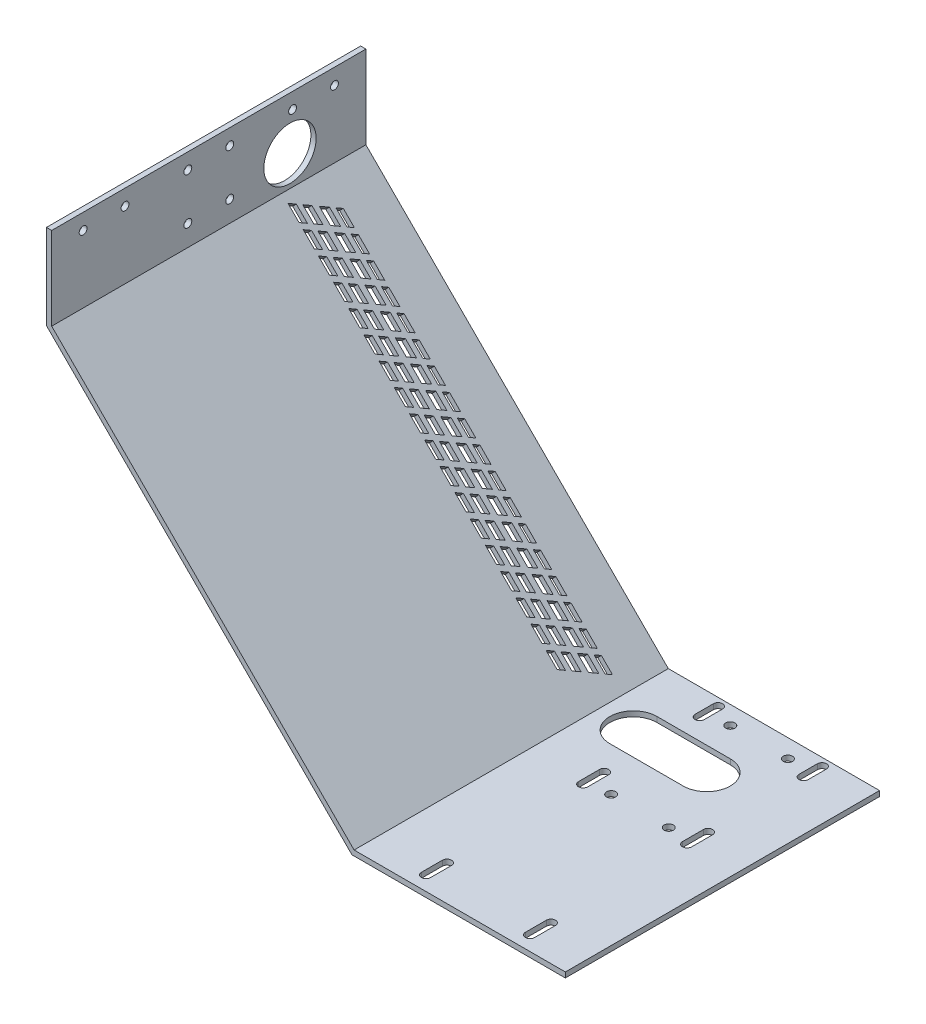
from build123d import *

# Parameters (mm, degrees)
EXTRUDE_1_DEPTH             = 120
CUT_EXTRUDE_1_DEPTH         = 307.169012533
CUT_EXTRUDE_2_DEPTH         = 277.26473236
CUT_EXTRUDE_3_DEPTH         = 277.26473236
CUT_EXTRUDE_4_DEPTH         = 277.26473236
CUT_EXTRUDE_5_DEPTH         = 277.26473236
CUT_EXTRUDE_6_DEPTH         = 277.26473236
CUT_EXTRUDE_7_DEPTH         = 277.26473236
CUT_EXTRUDE_8_DEPTH         = 204.855311096
CUT_EXTRUDE_9_DEPTH         = 204.855311096
CUT_EXTRUDE_10_DEPTH        = 204.855311096
CUT_EXTRUDE_11_DEPTH        = 204.855311096
CUT_EXTRUDE_12_DEPTH        = 204.855311096
CUT_EXTRUDE_13_DEPTH        = 204.855311096
CUT_EXTRUDE_14_DEPTH        = 204.855311096
CUT_EXTRUDE_15_DEPTH        = 204.855311096
CUT_EXTRUDE_16_DEPTH        = 204.855311096
CUT_EXTRUDE_17_DEPTH        = 204.855311096
CUT_EXTRUDE_18_DEPTH        = 204.855311096
CUT_EXTRUDE_19_DEPTH        = 204.855311096
CUT_EXTRUDE_20_DEPTH        = 204.855311096
CUT_EXTRUDE_21_DEPTH        = 204.855311096
CUT_EXTRUDE_22_DEPTH        = 204.855311096
CUT_EXTRUDE_23_DEPTH        = 204.855311096
CUT_EXTRUDE_24_DEPTH        = 204.855311096
CUT_EXTRUDE_25_DEPTH        = 204.855311096
CUT_EXTRUDE_26_DEPTH        = 204.855311096
CUT_EXTRUDE_27_DEPTH        = 204.855311096
CUT_EXTRUDE_28_DEPTH        = 204.855311096
CUT_EXTRUDE_29_DEPTH        = 204.855311096
CUT_EXTRUDE_30_DEPTH        = 204.855311096
CUT_EXTRUDE_31_DEPTH        = 204.855311096
CUT_EXTRUDE_32_DEPTH        = 204.855311096
CUT_EXTRUDE_33_DEPTH        = 204.855311096
CUT_EXTRUDE_34_DEPTH        = 204.855311096
CUT_EXTRUDE_35_DEPTH        = 204.855311096
CUT_EXTRUDE_36_DEPTH        = 204.855311096
CUT_EXTRUDE_37_DEPTH        = 204.855311096
CUT_EXTRUDE_38_DEPTH        = 204.855311096
CUT_EXTRUDE_39_DEPTH        = 204.855311096
CUT_EXTRUDE_40_DEPTH        = 204.855311096
CUT_EXTRUDE_41_DEPTH        = 204.855311096
CUT_EXTRUDE_42_DEPTH        = 204.855311096
CUT_EXTRUDE_43_DEPTH        = 204.855311096
CUT_EXTRUDE_44_DEPTH        = 204.855311096
CUT_EXTRUDE_45_DEPTH        = 204.855311096
CUT_EXTRUDE_46_DEPTH        = 204.855311096
CUT_EXTRUDE_47_DEPTH        = 204.855311096
CUT_EXTRUDE_48_DEPTH        = 204.855311096
CUT_EXTRUDE_49_DEPTH        = 204.855311096
CUT_EXTRUDE_50_DEPTH        = 204.855311096
CUT_EXTRUDE_51_DEPTH        = 204.855311096
CUT_EXTRUDE_52_DEPTH        = 204.855311096
CUT_EXTRUDE_53_DEPTH        = 204.855311096
CUT_EXTRUDE_54_DEPTH        = 204.855311096
CUT_EXTRUDE_55_DEPTH        = 204.855311096
CUT_EXTRUDE_56_DEPTH        = 204.855311096
CUT_EXTRUDE_57_DEPTH        = 204.855311096
CUT_EXTRUDE_58_DEPTH        = 204.855311096
CUT_EXTRUDE_59_DEPTH        = 204.855311096
CUT_EXTRUDE_60_DEPTH        = 204.855311096
CUT_EXTRUDE_61_DEPTH        = 204.855311096
CUT_EXTRUDE_62_DEPTH        = 204.855311096
CUT_EXTRUDE_63_DEPTH        = 204.855311096
CUT_EXTRUDE_64_DEPTH        = 204.855311096
CUT_EXTRUDE_65_DEPTH        = 204.855311096
CUT_EXTRUDE_66_DEPTH        = 204.855311096
CUT_EXTRUDE_67_DEPTH        = 204.855311096
CUT_EXTRUDE_68_DEPTH        = 204.855311096
CUT_EXTRUDE_69_DEPTH        = 204.855311096
CUT_EXTRUDE_70_DEPTH        = 204.855311096
CUT_EXTRUDE_71_DEPTH        = 204.855311096
CUT_EXTRUDE_72_DEPTH        = 204.855311096
CUT_EXTRUDE_73_DEPTH        = 204.855311096
CUT_EXTRUDE_74_DEPTH        = 204.855311096
CUT_EXTRUDE_75_DEPTH        = 204.855311096
CUT_EXTRUDE_76_DEPTH        = 204.855311096
CUT_EXTRUDE_77_DEPTH        = 204.855311096
CUT_EXTRUDE_78_DEPTH        = 204.855311096
CUT_EXTRUDE_79_DEPTH        = 204.855311096
CUT_EXTRUDE_80_DEPTH        = 276.189955977
HOLE_WIZARD_20_0_20_1_D     = 20
HOLE_WIZARD_20_0_20_1_DEPTH = 198.172618896
HOLE_WIZARD_3_0_3_1_D       = 3
HOLE_WIZARD_3_0_3_1_DEPTH   = 198.172618896
HOLE_WIZARD_3_5_3_5_1_D     = 3.5
HOLE_WIZARD_3_5_3_5_1_DEPTH = 149.172618896
HOLE_WIZARD_3_0_3_2_D       = 3


with BuildPart() as part:
    # 草图1 → 凸台-拉伸1 (new body)
    with BuildSketch(Plane(origin=(0, 0, 0), x_dir=(-1, 0, 0), z_dir=(0, 0, -1))):
        Polygon((199.172618896, -50), (1, -50), (1, -199.172618896), (82.5, -199.172618896), (199.172618896, -82.5), align=None)
    extrude(amount=-EXTRUDE_1_DEPTH)

    # 草图2 → 切除-拉伸1 (cut, through all)
    with BuildSketch(Plane.XY.offset(120)):
        Polygon((-197.172618896, -50), (-197.172618896, -81.671572875), (-81.671572875, -197.172618896), (-1, -197.172618896), (-1, -50), align=None)
    extrude(amount=-CUT_EXTRUDE_1_DEPTH, mode=Mode.SUBTRACT)

    # 草图3 → 切除-拉伸2 (cut, through all)
    with BuildSketch(Plane.XZ.offset(199.172618896)):
        with BuildLine():
            Line((-57.95, 106.5), (-57.95, 114.5))
            ThreePointArc((-57.95, 114.5), (-59.7, 116.25), (-61.45, 114.5))
            Line((-61.45, 114.5), (-61.45, 106.5))
            ThreePointArc((-61.45, 106.5), (-59.7, 104.75), (-57.95, 106.5))
        make_face()
    extrude(amount=-CUT_EXTRUDE_2_DEPTH, mode=Mode.SUBTRACT)

    # 草图4 → 切除-拉伸3 (cut, through all)
    with BuildSketch(Plane.XZ.offset(199.172618896)):
        with BuildLine():
            Line((-18.25, 106.5), (-18.25, 114.5))
            ThreePointArc((-18.25, 114.5), (-20, 116.25), (-21.75, 114.5))
            Line((-21.75, 114.5), (-21.75, 106.5))
            ThreePointArc((-21.75, 106.5), (-20, 104.75), (-18.25, 106.5))
        make_face()
    extrude(amount=-CUT_EXTRUDE_3_DEPTH, mode=Mode.SUBTRACT)

    # 草图5 → 切除-拉伸4 (cut, through all)
    with BuildSketch(Plane.XZ.offset(199.172618896)):
        with BuildLine():
            Line((-61.45, 54.5), (-61.45, 46.5))
            ThreePointArc((-61.45, 46.5), (-59.7, 44.75), (-57.95, 46.5))
            Line((-57.95, 46.5), (-57.95, 54.5))
            ThreePointArc((-57.95, 54.5), (-59.7, 56.25), (-61.45, 54.5))
        make_face()
    extrude(amount=-CUT_EXTRUDE_4_DEPTH, mode=Mode.SUBTRACT)

    # 草图6 → 切除-拉伸5 (cut, through all)
    with BuildSketch(Plane.XZ.offset(199.172618896)):
        with BuildLine():
            Line((-21.75, 54.5), (-21.75, 46.5))
            ThreePointArc((-21.75, 46.5), (-20, 44.75), (-18.25, 46.5))
            Line((-18.25, 46.5), (-18.25, 54.5))
            ThreePointArc((-18.25, 54.5), (-20, 56.25), (-21.75, 54.5))
        make_face()
    extrude(amount=-CUT_EXTRUDE_5_DEPTH, mode=Mode.SUBTRACT)

    # 草图7 → 切除-拉伸6 (cut, through all)
    with BuildSketch(Plane.XZ.offset(199.172618896)):
        with BuildLine():
            Line((-61.45, 10), (-61.45, 3))
            ThreePointArc((-61.45, 3), (-59.7, 1.25), (-57.95, 3))
            Line((-57.95, 3), (-57.95, 10))
            ThreePointArc((-57.95, 10), (-59.7, 11.75), (-61.45, 10))
        make_face()
    extrude(amount=-CUT_EXTRUDE_6_DEPTH, mode=Mode.SUBTRACT)

    # 草图8 → 切除-拉伸7 (cut, through all)
    with BuildSketch(Plane.XZ.offset(199.172618896)):
        with BuildLine():
            Line((-18.25, 3), (-18.25, 10))
            ThreePointArc((-18.25, 10), (-20, 11.75), (-21.75, 10))
            Line((-21.75, 10), (-21.75, 3))
            ThreePointArc((-21.75, 3), (-20, 1.25), (-18.25, 3))
        make_face()
    extrude(amount=-CUT_EXTRUDE_7_DEPTH, mode=Mode.SUBTRACT)

    # 草图9 → 切除-拉伸8 (cut, through all)
    with BuildSketch(Plane(origin=(-139.422095886, -139.422095886, 0), x_dir=(-0.7071067811865475, 0.7071067811865477, 0), z_dir=(0.7071067811865477, 0.7071067811865475, 0))):
        Polygon((-56.45277675, 25.5), (-55.009401077, 28), (-61.009401077, 28), (-62.45277675, 25.5), align=None)
    extrude(amount=-CUT_EXTRUDE_8_DEPTH, mode=Mode.SUBTRACT)

    # 草图10 → 切除-拉伸9 (cut, through all)
    with BuildSketch(Plane(origin=(-139.422095886, -139.422095886, 0), x_dir=(-0.7071067811865475, 0.7071067811865477, 0), z_dir=(0.7071067811865477, 0.7071067811865475, 0))):
        Polygon((-59.205553499, 20.732050808), (-57.607477288, 23.5), (-63.607477288, 23.5), (-65.205553499, 20.732050808), align=None)
    extrude(amount=-CUT_EXTRUDE_9_DEPTH, mode=Mode.SUBTRACT)

    # 草图11 → 切除-拉伸10 (cut, through all)
    with BuildSketch(Plane(origin=(-139.422095886, -139.422095886, 0), x_dir=(-0.7071067811865475, 0.7071067811865477, 0), z_dir=(0.7071067811865477, 0.7071067811865475, 0))):
        Polygon((-50.5, 32), (-51.809401077, 29.732050808), (-45.809401077, 29.732050808), (-44.5, 32), align=None)
    extrude(amount=-CUT_EXTRUDE_10_DEPTH, mode=Mode.SUBTRACT)

    # 草图12 → 切除-拉伸11 (cut, through all)
    with BuildSketch(Plane(origin=(-139.422095886, -139.422095886, 0), x_dir=(-0.7071067811865475, 0.7071067811865477, 0), z_dir=(0.7071067811865477, 0.7071067811865475, 0))):
        Polygon((-48.25277675, 25.5), (-46.809401077, 28), (-52.809401077, 28), (-54.25277675, 25.5), align=None)
    extrude(amount=-CUT_EXTRUDE_11_DEPTH, mode=Mode.SUBTRACT)

    # 草图13 → 切除-拉伸12 (cut, through all)
    with BuildSketch(Plane(origin=(-139.422095886, -139.422095886, 0), x_dir=(-0.7071067811865475, 0.7071067811865477, 0), z_dir=(0.7071067811865477, 0.7071067811865475, 0))):
        Polygon((-51.005553499, 20.732050808), (-49.407477288, 23.5), (-55.407477288, 23.5), (-57.005553499, 20.732050808), align=None)
    extrude(amount=-CUT_EXTRUDE_12_DEPTH, mode=Mode.SUBTRACT)

    # 草图14 → 切除-拉伸13 (cut, through all)
    with BuildSketch(Plane(origin=(-139.422095886, -139.422095886, 0), x_dir=(-0.7071067811865475, 0.7071067811865477, 0), z_dir=(0.7071067811865477, 0.7071067811865475, 0))):
        Polygon((-42.3, 32), (-43.609401077, 29.732050808), (-37.609401077, 29.732050808), (-36.3, 32), align=None)
    extrude(amount=-CUT_EXTRUDE_13_DEPTH, mode=Mode.SUBTRACT)

    # 草图15 → 切除-拉伸14 (cut, through all)
    with BuildSketch(Plane(origin=(-139.422095886, -139.422095886, 0), x_dir=(-0.7071067811865475, 0.7071067811865477, 0), z_dir=(0.7071067811865477, 0.7071067811865475, 0))):
        Polygon((-40.05277675, 25.5), (-38.609401077, 28), (-44.609401077, 28), (-46.05277675, 25.5), align=None)
    extrude(amount=-CUT_EXTRUDE_14_DEPTH, mode=Mode.SUBTRACT)

    # 草图16 → 切除-拉伸15 (cut, through all)
    with BuildSketch(Plane(origin=(-139.422095886, -139.422095886, 0), x_dir=(-0.7071067811865475, 0.7071067811865477, 0), z_dir=(0.7071067811865477, 0.7071067811865475, 0))):
        Polygon((-42.805553499, 20.732050808), (-41.207477288, 23.5), (-47.207477288, 23.5), (-48.805553499, 20.732050808), align=None)
    extrude(amount=-CUT_EXTRUDE_15_DEPTH, mode=Mode.SUBTRACT)

    # 草图17 → 切除-拉伸16 (cut, through all)
    with BuildSketch(Plane(origin=(-139.422095886, -139.422095886, 0), x_dir=(-0.7071067811865475, 0.7071067811865477, 0), z_dir=(0.7071067811865477, 0.7071067811865475, 0))):
        Polygon((-34.1, 32), (-35.409401077, 29.732050808), (-29.409401077, 29.732050808), (-28.1, 32), align=None)
    extrude(amount=-CUT_EXTRUDE_16_DEPTH, mode=Mode.SUBTRACT)

    # 草图18 → 切除-拉伸17 (cut, through all)
    with BuildSketch(Plane(origin=(-139.422095886, -139.422095886, 0), x_dir=(-0.7071067811865475, 0.7071067811865477, 0), z_dir=(0.7071067811865477, 0.7071067811865475, 0))):
        Polygon((-31.85277675, 25.5), (-30.409401077, 28), (-36.409401077, 28), (-37.85277675, 25.5), align=None)
    extrude(amount=-CUT_EXTRUDE_17_DEPTH, mode=Mode.SUBTRACT)

    # 草图19 → 切除-拉伸18 (cut, through all)
    with BuildSketch(Plane(origin=(-139.422095886, -139.422095886, 0), x_dir=(-0.7071067811865475, 0.7071067811865477, 0), z_dir=(0.7071067811865477, 0.7071067811865475, 0))):
        Polygon((-34.605553499, 20.732050808), (-33.007477288, 23.5), (-39.007477288, 23.5), (-40.605553499, 20.732050808), align=None)
    extrude(amount=-CUT_EXTRUDE_18_DEPTH, mode=Mode.SUBTRACT)

    # 草图20 → 切除-拉伸19 (cut, through all)
    with BuildSketch(Plane(origin=(-139.422095886, -139.422095886, 0), x_dir=(-0.7071067811865475, 0.7071067811865477, 0), z_dir=(0.7071067811865477, 0.7071067811865475, 0))):
        Polygon((-25.9, 32), (-27.209401077, 29.732050808), (-21.209401077, 29.732050808), (-19.9, 32), align=None)
    extrude(amount=-CUT_EXTRUDE_19_DEPTH, mode=Mode.SUBTRACT)

    # 草图21 → 切除-拉伸20 (cut, through all)
    with BuildSketch(Plane(origin=(-139.422095886, -139.422095886, 0), x_dir=(-0.7071067811865475, 0.7071067811865477, 0), z_dir=(0.7071067811865477, 0.7071067811865475, 0))):
        Polygon((-23.65277675, 25.5), (-22.209401077, 28), (-28.209401077, 28), (-29.65277675, 25.5), align=None)
    extrude(amount=-CUT_EXTRUDE_20_DEPTH, mode=Mode.SUBTRACT)

    # 草图22 → 切除-拉伸21 (cut, through all)
    with BuildSketch(Plane(origin=(-139.422095886, -139.422095886, 0), x_dir=(-0.7071067811865475, 0.7071067811865477, 0), z_dir=(0.7071067811865477, 0.7071067811865475, 0))):
        Polygon((-26.405553499, 20.732050808), (-24.807477288, 23.5), (-30.807477288, 23.5), (-32.4055535, 20.732050808), align=None)
    extrude(amount=-CUT_EXTRUDE_21_DEPTH, mode=Mode.SUBTRACT)

    # 草图23 → 切除-拉伸22 (cut, through all)
    with BuildSketch(Plane(origin=(-139.422095886, -139.422095886, 0), x_dir=(-0.7071067811865475, 0.7071067811865477, 0), z_dir=(0.7071067811865477, 0.7071067811865475, 0))):
        Polygon((-17.7, 32), (-19.009401077, 29.732050808), (-13.009401077, 29.732050808), (-11.7, 32), align=None)
    extrude(amount=-CUT_EXTRUDE_22_DEPTH, mode=Mode.SUBTRACT)

    # 草图24 → 切除-拉伸23 (cut, through all)
    with BuildSketch(Plane(origin=(-139.422095886, -139.422095886, 0), x_dir=(-0.7071067811865475, 0.7071067811865477, 0), z_dir=(0.7071067811865477, 0.7071067811865475, 0))):
        Polygon((-15.45277675, 25.5), (-14.009401077, 28), (-20.009401077, 28), (-21.45277675, 25.5), align=None)
    extrude(amount=-CUT_EXTRUDE_23_DEPTH, mode=Mode.SUBTRACT)

    # 草图25 → 切除-拉伸24 (cut, through all)
    with BuildSketch(Plane(origin=(-139.422095886, -139.422095886, 0), x_dir=(-0.7071067811865475, 0.7071067811865477, 0), z_dir=(0.7071067811865477, 0.7071067811865475, 0))):
        Polygon((-18.205553499, 20.732050808), (-16.607477288, 23.5), (-22.607477288, 23.5), (-24.205553499, 20.732050808), align=None)
    extrude(amount=-CUT_EXTRUDE_24_DEPTH, mode=Mode.SUBTRACT)

    # 草图26 → 切除-拉伸25 (cut, through all)
    with BuildSketch(Plane(origin=(-139.422095886, -139.422095886, 0), x_dir=(-0.7071067811865475, 0.7071067811865477, 0), z_dir=(0.7071067811865477, 0.7071067811865475, 0))):
        Polygon((-9.5, 32), (-10.809401077, 29.732050808), (-4.809401077, 29.732050808), (-3.5, 32), align=None)
    extrude(amount=-CUT_EXTRUDE_25_DEPTH, mode=Mode.SUBTRACT)

    # 草图27 → 切除-拉伸26 (cut, through all)
    with BuildSketch(Plane(origin=(-139.422095886, -139.422095886, 0), x_dir=(-0.7071067811865475, 0.7071067811865477, 0), z_dir=(0.7071067811865477, 0.7071067811865475, 0))):
        Polygon((-7.25277675, 25.5), (-5.809401077, 28), (-11.809401077, 28), (-13.25277675, 25.5), align=None)
    extrude(amount=-CUT_EXTRUDE_26_DEPTH, mode=Mode.SUBTRACT)

    # 草图28 → 切除-拉伸27 (cut, through all)
    with BuildSketch(Plane(origin=(-139.422095886, -139.422095886, 0), x_dir=(-0.7071067811865475, 0.7071067811865477, 0), z_dir=(0.7071067811865477, 0.7071067811865475, 0))):
        Polygon((-10.005553499, 20.732050808), (-8.407477288, 23.5), (-14.407477288, 23.5), (-16.005553499, 20.732050808), align=None)
    extrude(amount=-CUT_EXTRUDE_27_DEPTH, mode=Mode.SUBTRACT)

    # 草图29 → 切除-拉伸28 (cut, through all)
    with BuildSketch(Plane(origin=(-139.422095886, -139.422095886, 0), x_dir=(-0.7071067811865475, 0.7071067811865477, 0), z_dir=(0.7071067811865477, 0.7071067811865475, 0))):
        Polygon((-1.3, 32), (-2.609401077, 29.732050808), (3.390598923, 29.732050808), (4.7, 32), align=None)
    extrude(amount=-CUT_EXTRUDE_28_DEPTH, mode=Mode.SUBTRACT)

    # 草图30 → 切除-拉伸29 (cut, through all)
    with BuildSketch(Plane(origin=(-139.422095886, -139.422095886, 0), x_dir=(-0.7071067811865475, 0.7071067811865477, 0), z_dir=(0.7071067811865477, 0.7071067811865475, 0))):
        Polygon((0.94722325, 25.5), (2.390598923, 28), (-3.609401077, 28), (-5.05277675, 25.5), align=None)
    extrude(amount=-CUT_EXTRUDE_29_DEPTH, mode=Mode.SUBTRACT)

    # 草图31 → 切除-拉伸30 (cut, through all)
    with BuildSketch(Plane(origin=(-139.422095886, -139.422095886, 0), x_dir=(-0.7071067811865475, 0.7071067811865477, 0), z_dir=(0.7071067811865477, 0.7071067811865475, 0))):
        Polygon((-1.805553499, 20.732050808), (-0.207477288, 23.5), (-6.207477288, 23.5), (-7.805553499, 20.732050808), align=None)
    extrude(amount=-CUT_EXTRUDE_30_DEPTH, mode=Mode.SUBTRACT)

    # 草图32 → 切除-拉伸31 (cut, through all)
    with BuildSketch(Plane(origin=(-139.422095886, -139.422095886, 0), x_dir=(-0.7071067811865475, 0.7071067811865477, 0), z_dir=(0.7071067811865477, 0.7071067811865475, 0))):
        Polygon((6.9, 32), (5.590598923, 29.732050808), (11.590598923, 29.732050808), (12.9, 32), align=None)
    extrude(amount=-CUT_EXTRUDE_31_DEPTH, mode=Mode.SUBTRACT)

    # 草图33 → 切除-拉伸32 (cut, through all)
    with BuildSketch(Plane(origin=(-139.422095886, -139.422095886, 0), x_dir=(-0.7071067811865475, 0.7071067811865477, 0), z_dir=(0.7071067811865477, 0.7071067811865475, 0))):
        Polygon((9.14722325, 25.5), (10.590598923, 28), (4.590598923, 28), (3.14722325, 25.5), align=None)
    extrude(amount=-CUT_EXTRUDE_32_DEPTH, mode=Mode.SUBTRACT)

    # 草图34 → 切除-拉伸33 (cut, through all)
    with BuildSketch(Plane(origin=(-139.422095886, -139.422095886, 0), x_dir=(-0.7071067811865475, 0.7071067811865477, 0), z_dir=(0.7071067811865477, 0.7071067811865475, 0))):
        Polygon((6.394446501, 20.732050808), (7.992522712, 23.5), (1.992522712, 23.5), (0.394446501, 20.732050808), align=None)
    extrude(amount=-CUT_EXTRUDE_33_DEPTH, mode=Mode.SUBTRACT)

    # 草图35 → 切除-拉伸34 (cut, through all)
    with BuildSketch(Plane(origin=(-139.422095886, -139.422095886, 0), x_dir=(-0.7071067811865475, 0.7071067811865477, 0), z_dir=(0.7071067811865477, 0.7071067811865475, 0))):
        Polygon((15.1, 32), (13.790598923, 29.732050808), (19.790598923, 29.732050808), (21.1, 32), align=None)
    extrude(amount=-CUT_EXTRUDE_34_DEPTH, mode=Mode.SUBTRACT)

    # 草图36 → 切除-拉伸35 (cut, through all)
    with BuildSketch(Plane(origin=(-139.422095886, -139.422095886, 0), x_dir=(-0.7071067811865475, 0.7071067811865477, 0), z_dir=(0.7071067811865477, 0.7071067811865475, 0))):
        Polygon((17.34722325, 25.5), (18.790598923, 28), (12.790598923, 28), (11.34722325, 25.5), align=None)
    extrude(amount=-CUT_EXTRUDE_35_DEPTH, mode=Mode.SUBTRACT)

    # 草图37 → 切除-拉伸36 (cut, through all)
    with BuildSketch(Plane(origin=(-139.422095886, -139.422095886, 0), x_dir=(-0.7071067811865475, 0.7071067811865477, 0), z_dir=(0.7071067811865477, 0.7071067811865475, 0))):
        Polygon((14.594446501, 20.732050808), (16.192522712, 23.5), (10.192522712, 23.5), (8.594446501, 20.732050808), align=None)
    extrude(amount=-CUT_EXTRUDE_36_DEPTH, mode=Mode.SUBTRACT)

    # 草图38 → 切除-拉伸37 (cut, through all)
    with BuildSketch(Plane(origin=(-139.422095886, -139.422095886, 0), x_dir=(-0.7071067811865475, 0.7071067811865477, 0), z_dir=(0.7071067811865477, 0.7071067811865475, 0))):
        Polygon((23.3, 32), (21.990598923, 29.732050808), (27.990598923, 29.732050808), (29.3, 32), align=None)
    extrude(amount=-CUT_EXTRUDE_37_DEPTH, mode=Mode.SUBTRACT)

    # 草图39 → 切除-拉伸38 (cut, through all)
    with BuildSketch(Plane(origin=(-139.422095886, -139.422095886, 0), x_dir=(-0.7071067811865475, 0.7071067811865477, 0), z_dir=(0.7071067811865477, 0.7071067811865475, 0))):
        Polygon((25.54722325, 25.5), (26.990598923, 28), (20.990598923, 28), (19.54722325, 25.5), align=None)
    extrude(amount=-CUT_EXTRUDE_38_DEPTH, mode=Mode.SUBTRACT)

    # 草图40 → 切除-拉伸39 (cut, through all)
    with BuildSketch(Plane(origin=(-139.422095886, -139.422095886, 0), x_dir=(-0.7071067811865475, 0.7071067811865477, 0), z_dir=(0.7071067811865477, 0.7071067811865475, 0))):
        Polygon((22.794446501, 20.732050808), (24.392522712, 23.5), (18.392522712, 23.5), (16.794446501, 20.732050808), align=None)
    extrude(amount=-CUT_EXTRUDE_39_DEPTH, mode=Mode.SUBTRACT)

    # 草图41 → 切除-拉伸40 (cut, through all)
    with BuildSketch(Plane(origin=(-139.422095886, -139.422095886, 0), x_dir=(-0.7071067811865475, 0.7071067811865477, 0), z_dir=(0.7071067811865477, 0.7071067811865475, 0))):
        Polygon((31.5, 32), (30.190598923, 29.732050808), (36.190598923, 29.732050808), (37.5, 32), align=None)
    extrude(amount=-CUT_EXTRUDE_40_DEPTH, mode=Mode.SUBTRACT)

    # 草图42 → 切除-拉伸41 (cut, through all)
    with BuildSketch(Plane(origin=(-139.422095886, -139.422095886, 0), x_dir=(-0.7071067811865475, 0.7071067811865477, 0), z_dir=(0.7071067811865477, 0.7071067811865475, 0))):
        Polygon((33.74722325, 25.5), (35.190598923, 28), (29.190598923, 28), (27.74722325, 25.5), align=None)
    extrude(amount=-CUT_EXTRUDE_41_DEPTH, mode=Mode.SUBTRACT)

    # 草图43 → 切除-拉伸42 (cut, through all)
    with BuildSketch(Plane(origin=(-139.422095886, -139.422095886, 0), x_dir=(-0.7071067811865475, 0.7071067811865477, 0), z_dir=(0.7071067811865477, 0.7071067811865475, 0))):
        Polygon((30.994446501, 20.732050808), (32.592522712, 23.5), (26.592522712, 23.5), (24.9944465, 20.732050808), align=None)
    extrude(amount=-CUT_EXTRUDE_42_DEPTH, mode=Mode.SUBTRACT)

    # 草图44 → 切除-拉伸43 (cut, through all)
    with BuildSketch(Plane(origin=(-139.422095886, -139.422095886, 0), x_dir=(-0.7071067811865475, 0.7071067811865477, 0), z_dir=(0.7071067811865477, 0.7071067811865475, 0))):
        Polygon((39.7, 32), (38.390598923, 29.732050808), (44.390598923, 29.732050808), (45.7, 32), align=None)
    extrude(amount=-CUT_EXTRUDE_43_DEPTH, mode=Mode.SUBTRACT)

    # 草图45 → 切除-拉伸44 (cut, through all)
    with BuildSketch(Plane(origin=(-139.422095886, -139.422095886, 0), x_dir=(-0.7071067811865475, 0.7071067811865477, 0), z_dir=(0.7071067811865477, 0.7071067811865475, 0))):
        Polygon((41.94722325, 25.5), (43.390598923, 28), (37.390598923, 28), (35.94722325, 25.5), align=None)
    extrude(amount=-CUT_EXTRUDE_44_DEPTH, mode=Mode.SUBTRACT)

    # 草图46 → 切除-拉伸45 (cut, through all)
    with BuildSketch(Plane(origin=(-139.422095886, -139.422095886, 0), x_dir=(-0.7071067811865475, 0.7071067811865477, 0), z_dir=(0.7071067811865477, 0.7071067811865475, 0))):
        Polygon((39.194446501, 20.732050808), (40.792522712, 23.5), (34.792522712, 23.5), (33.194446501, 20.732050808), align=None)
    extrude(amount=-CUT_EXTRUDE_45_DEPTH, mode=Mode.SUBTRACT)

    # 草图47 → 切除-拉伸46 (cut, through all)
    with BuildSketch(Plane(origin=(-139.422095886, -139.422095886, 0), x_dir=(-0.7071067811865475, 0.7071067811865477, 0), z_dir=(0.7071067811865477, 0.7071067811865475, 0))):
        Polygon((47.9, 32), (46.590598923, 29.732050808), (52.590598923, 29.732050808), (53.9, 32), align=None)
    extrude(amount=-CUT_EXTRUDE_46_DEPTH, mode=Mode.SUBTRACT)

    # 草图48 → 切除-拉伸47 (cut, through all)
    with BuildSketch(Plane(origin=(-139.422095886, -139.422095886, 0), x_dir=(-0.7071067811865475, 0.7071067811865477, 0), z_dir=(0.7071067811865477, 0.7071067811865475, 0))):
        Polygon((50.14722325, 25.5), (51.590598923, 28), (45.590598923, 28), (44.14722325, 25.5), align=None)
    extrude(amount=-CUT_EXTRUDE_47_DEPTH, mode=Mode.SUBTRACT)

    # 草图49 → 切除-拉伸48 (cut, through all)
    with BuildSketch(Plane(origin=(-139.422095886, -139.422095886, 0), x_dir=(-0.7071067811865475, 0.7071067811865477, 0), z_dir=(0.7071067811865477, 0.7071067811865475, 0))):
        Polygon((47.394446501, 20.732050808), (48.992522712, 23.5), (42.992522712, 23.5), (41.394446501, 20.732050808), align=None)
    extrude(amount=-CUT_EXTRUDE_48_DEPTH, mode=Mode.SUBTRACT)

    # 草图50 → 切除-拉伸49 (cut, through all)
    with BuildSketch(Plane(origin=(-139.422095886, -139.422095886, 0), x_dir=(-0.7071067811865475, 0.7071067811865477, 0), z_dir=(0.7071067811865477, 0.7071067811865475, 0))):
        Polygon((56.1, 32), (54.790598923, 29.732050808), (60.790598923, 29.732050808), (62.1, 32), align=None)
    extrude(amount=-CUT_EXTRUDE_49_DEPTH, mode=Mode.SUBTRACT)

    # 草图51 → 切除-拉伸50 (cut, through all)
    with BuildSketch(Plane(origin=(-139.422095886, -139.422095886, 0), x_dir=(-0.7071067811865475, 0.7071067811865477, 0), z_dir=(0.7071067811865477, 0.7071067811865475, 0))):
        Polygon((58.34722325, 25.5), (59.790598923, 28), (53.790598923, 28), (52.34722325, 25.5), align=None)
    extrude(amount=-CUT_EXTRUDE_50_DEPTH, mode=Mode.SUBTRACT)

    # 草图52 → 切除-拉伸51 (cut, through all)
    with BuildSketch(Plane(origin=(-139.422095886, -139.422095886, 0), x_dir=(-0.7071067811865475, 0.7071067811865477, 0), z_dir=(0.7071067811865477, 0.7071067811865475, 0))):
        Polygon((55.594446501, 20.732050808), (57.192522712, 23.5), (51.192522712, 23.5), (49.594446501, 20.732050808), align=None)
    extrude(amount=-CUT_EXTRUDE_51_DEPTH, mode=Mode.SUBTRACT)

    # 草图53 → 切除-拉伸52 (cut, through all)
    with BuildSketch(Plane(origin=(-139.422095886, -139.422095886, 0), x_dir=(-0.7071067811865475, 0.7071067811865477, 0), z_dir=(0.7071067811865477, 0.7071067811865475, 0))):
        Polygon((-69.560254038, 17), (-68.405553499, 19), (-74.405553499, 19), (-75.560254038, 17), align=None)
    extrude(amount=-CUT_EXTRUDE_52_DEPTH, mode=Mode.SUBTRACT)

    # 草图54 → 切除-拉伸53 (cut, through all)
    with BuildSketch(Plane(origin=(-139.422095886, -139.422095886, 0), x_dir=(-0.7071067811865475, 0.7071067811865477, 0), z_dir=(0.7071067811865477, 0.7071067811865475, 0))):
        Polygon((64.3, 32), (62.990598923, 29.732050808), (68.990598923, 29.732050808), (70.3, 32), align=None)
    extrude(amount=-CUT_EXTRUDE_53_DEPTH, mode=Mode.SUBTRACT)

    # 草图55 → 切除-拉伸54 (cut, through all)
    with BuildSketch(Plane(origin=(-139.422095886, -139.422095886, 0), x_dir=(-0.7071067811865475, 0.7071067811865477, 0), z_dir=(0.7071067811865477, 0.7071067811865475, 0))):
        Polygon((66.54722325, 25.5), (67.990598923, 28), (61.990598923, 28), (60.54722325, 25.5), align=None)
    extrude(amount=-CUT_EXTRUDE_54_DEPTH, mode=Mode.SUBTRACT)

    # 草图56 → 切除-拉伸55 (cut, through all)
    with BuildSketch(Plane(origin=(-139.422095886, -139.422095886, 0), x_dir=(-0.7071067811865475, 0.7071067811865477, 0), z_dir=(0.7071067811865477, 0.7071067811865475, 0))):
        Polygon((63.794446501, 20.732050808), (65.392522712, 23.5), (59.392522712, 23.5), (57.794446501, 20.732050808), align=None)
    extrude(amount=-CUT_EXTRUDE_55_DEPTH, mode=Mode.SUBTRACT)

    # 草图57 → 切除-拉伸56 (cut, through all)
    with BuildSketch(Plane(origin=(-139.422095886, -139.422095886, 0), x_dir=(-0.7071067811865475, 0.7071067811865477, 0), z_dir=(0.7071067811865477, 0.7071067811865475, 0))):
        Polygon((-71.807477288, 23.5), (-73.405553499, 20.732050808), (-67.405553499, 20.732050808), (-65.807477288, 23.5), align=None)
    extrude(amount=-CUT_EXTRUDE_56_DEPTH, mode=Mode.SUBTRACT)

    # 草图58 → 切除-拉伸57 (cut, through all)
    with BuildSketch(Plane(origin=(-139.422095886, -139.422095886, 0), x_dir=(-0.7071067811865475, 0.7071067811865477, 0), z_dir=(0.7071067811865477, 0.7071067811865475, 0))):
        Polygon((-69.209401077, 28), (-70.65277675, 25.5), (-64.65277675, 25.5), (-63.209401077, 28), align=None)
    extrude(amount=-CUT_EXTRUDE_57_DEPTH, mode=Mode.SUBTRACT)

    # 草图59 → 切除-拉伸58 (cut, through all)
    with BuildSketch(Plane(origin=(-139.422095886, -139.422095886, 0), x_dir=(-0.7071067811865475, 0.7071067811865477, 0), z_dir=(0.7071067811865477, 0.7071067811865475, 0))):
        Polygon((67.592522712, 23.5), (65.994446501, 20.732050808), (71.994446501, 20.732050808), (73.592522712, 23.5), align=None)
    extrude(amount=-CUT_EXTRUDE_58_DEPTH, mode=Mode.SUBTRACT)

    # 草图60 → 切除-拉伸59 (cut, through all)
    with BuildSketch(Plane(origin=(-139.422095886, -139.422095886, 0), x_dir=(-0.7071067811865475, 0.7071067811865477, 0), z_dir=(0.7071067811865477, 0.7071067811865475, 0))):
        Polygon((70.190598923, 28), (68.74722325, 25.5), (74.74722325, 25.5), (76.190598923, 28), align=None)
    extrude(amount=-CUT_EXTRUDE_59_DEPTH, mode=Mode.SUBTRACT)

    # 草图61 → 切除-拉伸60 (cut, through all)
    with BuildSketch(Plane(origin=(-139.422095886, -139.422095886, 0), x_dir=(-0.7071067811865475, 0.7071067811865477, 0), z_dir=(0.7071067811865477, 0.7071067811865475, 0))):
        Polygon((72.5, 32), (71.190598923, 29.732050808), (77.190598923, 29.732050808), (78.5, 32), align=None)
    extrude(amount=-CUT_EXTRUDE_60_DEPTH, mode=Mode.SUBTRACT)

    # 草图62 → 切除-拉伸61 (cut, through all)
    with BuildSketch(Plane(origin=(-139.422095886, -139.422095886, 0), x_dir=(-0.7071067811865475, 0.7071067811865477, 0), z_dir=(0.7071067811865477, 0.7071067811865475, 0))):
        Polygon((-58.7, 32), (-60.009401077, 29.732050808), (-54.009401077, 29.732050808), (-52.7, 32), align=None)
    extrude(amount=-CUT_EXTRUDE_61_DEPTH, mode=Mode.SUBTRACT)

    # 草图63 → 切除-拉伸62 (cut, through all)
    with BuildSketch(Plane(origin=(-139.422095886, -139.422095886, 0), x_dir=(-0.7071067811865475, 0.7071067811865477, 0), z_dir=(0.7071067811865477, 0.7071067811865475, 0))):
        Polygon((69.839745962, 17), (70.994446501, 19), (64.994446501, 19), (63.839745962, 17), align=None)
    extrude(amount=-CUT_EXTRUDE_62_DEPTH, mode=Mode.SUBTRACT)

    # 草图64 → 切除-拉伸63 (cut, through all)
    with BuildSketch(Plane(origin=(-139.422095886, -139.422095886, 0), x_dir=(-0.7071067811865475, 0.7071067811865477, 0), z_dir=(0.7071067811865477, 0.7071067811865475, 0))):
        Polygon((-66.9, 32), (-68.209401077, 29.732050808), (-62.209401077, 29.732050808), (-60.9, 32), align=None)
    extrude(amount=-CUT_EXTRUDE_63_DEPTH, mode=Mode.SUBTRACT)

    # 草图65 → 切除-拉伸64 (cut, through all)
    with BuildSketch(Plane(origin=(-139.422095886, -139.422095886, 0), x_dir=(-0.7071067811865475, 0.7071067811865477, 0), z_dir=(0.7071067811865477, 0.7071067811865475, 0))):
        Polygon((61.639745962, 17), (62.794446501, 19), (56.794446501, 19), (55.639745962, 17), align=None)
    extrude(amount=-CUT_EXTRUDE_64_DEPTH, mode=Mode.SUBTRACT)

    # 草图66 → 切除-拉伸65 (cut, through all)
    with BuildSketch(Plane(origin=(-139.422095886, -139.422095886, 0), x_dir=(-0.7071067811865475, 0.7071067811865477, 0), z_dir=(0.7071067811865477, 0.7071067811865475, 0))):
        Polygon((53.439745962, 17), (54.594446501, 19), (48.594446501, 19), (47.439745962, 17), align=None)
    extrude(amount=-CUT_EXTRUDE_65_DEPTH, mode=Mode.SUBTRACT)

    # 草图67 → 切除-拉伸66 (cut, through all)
    with BuildSketch(Plane(origin=(-139.422095886, -139.422095886, 0), x_dir=(-0.7071067811865475, 0.7071067811865477, 0), z_dir=(0.7071067811865477, 0.7071067811865475, 0))):
        Polygon((45.239745962, 17), (46.394446501, 19), (40.394446501, 19), (39.239745962, 17), align=None)
    extrude(amount=-CUT_EXTRUDE_66_DEPTH, mode=Mode.SUBTRACT)

    # 草图68 → 切除-拉伸67 (cut, through all)
    with BuildSketch(Plane(origin=(-139.422095886, -139.422095886, 0), x_dir=(-0.7071067811865475, 0.7071067811865477, 0), z_dir=(0.7071067811865477, 0.7071067811865475, 0))):
        Polygon((37.039745962, 17), (38.194446501, 19), (32.194446501, 19), (31.039745962, 17), align=None)
    extrude(amount=-CUT_EXTRUDE_67_DEPTH, mode=Mode.SUBTRACT)

    # 草图69 → 切除-拉伸68 (cut, through all)
    with BuildSketch(Plane(origin=(-139.422095886, -139.422095886, 0), x_dir=(-0.7071067811865475, 0.7071067811865477, 0), z_dir=(0.7071067811865477, 0.7071067811865475, 0))):
        Polygon((28.839745962, 17), (29.994446501, 19), (23.994446501, 19), (22.839745962, 17), align=None)
    extrude(amount=-CUT_EXTRUDE_68_DEPTH, mode=Mode.SUBTRACT)

    # 草图70 → 切除-拉伸69 (cut, through all)
    with BuildSketch(Plane(origin=(-139.422095886, -139.422095886, 0), x_dir=(-0.7071067811865475, 0.7071067811865477, 0), z_dir=(0.7071067811865477, 0.7071067811865475, 0))):
        Polygon((20.639745962, 17), (21.794446501, 19), (15.794446501, 19), (14.639745962, 17), align=None)
    extrude(amount=-CUT_EXTRUDE_69_DEPTH, mode=Mode.SUBTRACT)

    # 草图71 → 切除-拉伸70 (cut, through all)
    with BuildSketch(Plane(origin=(-139.422095886, -139.422095886, 0), x_dir=(-0.7071067811865475, 0.7071067811865477, 0), z_dir=(0.7071067811865477, 0.7071067811865475, 0))):
        Polygon((12.439745962, 17), (13.594446501, 19), (7.594446501, 19), (6.439745962, 17), align=None)
    extrude(amount=-CUT_EXTRUDE_70_DEPTH, mode=Mode.SUBTRACT)

    # 草图72 → 切除-拉伸71 (cut, through all)
    with BuildSketch(Plane(origin=(-139.422095886, -139.422095886, 0), x_dir=(-0.7071067811865475, 0.7071067811865477, 0), z_dir=(0.7071067811865477, 0.7071067811865475, 0))):
        Polygon((4.239745962, 17), (5.394446501, 19), (-0.605553499, 19), (-1.760254038, 17), align=None)
    extrude(amount=-CUT_EXTRUDE_71_DEPTH, mode=Mode.SUBTRACT)

    # 草图73 → 切除-拉伸72 (cut, through all)
    with BuildSketch(Plane(origin=(-139.422095886, -139.422095886, 0), x_dir=(-0.7071067811865475, 0.7071067811865477, 0), z_dir=(0.7071067811865477, 0.7071067811865475, 0))):
        Polygon((-3.960254038, 17), (-2.805553499, 19), (-8.805553499, 19), (-9.960254038, 17), align=None)
    extrude(amount=-CUT_EXTRUDE_72_DEPTH, mode=Mode.SUBTRACT)

    # 草图74 → 切除-拉伸73 (cut, through all)
    with BuildSketch(Plane(origin=(-139.422095886, -139.422095886, 0), x_dir=(-0.7071067811865475, 0.7071067811865477, 0), z_dir=(0.7071067811865477, 0.7071067811865475, 0))):
        Polygon((-12.160254038, 17), (-11.005553499, 19), (-17.005553499, 19), (-18.160254038, 17), align=None)
    extrude(amount=-CUT_EXTRUDE_73_DEPTH, mode=Mode.SUBTRACT)

    # 草图75 → 切除-拉伸74 (cut, through all)
    with BuildSketch(Plane(origin=(-139.422095886, -139.422095886, 0), x_dir=(-0.7071067811865475, 0.7071067811865477, 0), z_dir=(0.7071067811865477, 0.7071067811865475, 0))):
        Polygon((-20.360254038, 17), (-19.205553499, 19), (-25.205553499, 19), (-26.360254038, 17), align=None)
    extrude(amount=-CUT_EXTRUDE_74_DEPTH, mode=Mode.SUBTRACT)

    # 草图76 → 切除-拉伸75 (cut, through all)
    with BuildSketch(Plane(origin=(-139.422095886, -139.422095886, 0), x_dir=(-0.7071067811865475, 0.7071067811865477, 0), z_dir=(0.7071067811865477, 0.7071067811865475, 0))):
        Polygon((-28.560254038, 17), (-27.405553499, 19), (-33.405553499, 19), (-34.560254038, 17), align=None)
    extrude(amount=-CUT_EXTRUDE_75_DEPTH, mode=Mode.SUBTRACT)

    # 草图77 → 切除-拉伸76 (cut, through all)
    with BuildSketch(Plane(origin=(-139.422095886, -139.422095886, 0), x_dir=(-0.7071067811865475, 0.7071067811865477, 0), z_dir=(0.7071067811865477, 0.7071067811865475, 0))):
        Polygon((-36.760254038, 17), (-35.605553499, 19), (-41.605553499, 19), (-42.760254038, 17), align=None)
    extrude(amount=-CUT_EXTRUDE_76_DEPTH, mode=Mode.SUBTRACT)

    # 草图78 → 切除-拉伸77 (cut, through all)
    with BuildSketch(Plane(origin=(-139.422095886, -139.422095886, 0), x_dir=(-0.7071067811865475, 0.7071067811865477, 0), z_dir=(0.7071067811865477, 0.7071067811865475, 0))):
        Polygon((-44.960254038, 17), (-43.805553499, 19), (-49.805553499, 19), (-50.960254038, 17), align=None)
    extrude(amount=-CUT_EXTRUDE_77_DEPTH, mode=Mode.SUBTRACT)

    # 草图79 → 切除-拉伸78 (cut, through all)
    with BuildSketch(Plane(origin=(-139.422095886, -139.422095886, 0), x_dir=(-0.7071067811865475, 0.7071067811865477, 0), z_dir=(0.7071067811865477, 0.7071067811865475, 0))):
        Polygon((-53.160254038, 17), (-52.005553499, 19), (-58.005553499, 19), (-59.160254038, 17), align=None)
    extrude(amount=-CUT_EXTRUDE_78_DEPTH, mode=Mode.SUBTRACT)

    # 草图80 → 切除-拉伸79 (cut, through all)
    with BuildSketch(Plane(origin=(-139.422095886, -139.422095886, 0), x_dir=(-0.7071067811865475, 0.7071067811865477, 0), z_dir=(0.7071067811865477, 0.7071067811865475, 0))):
        Polygon((-61.360254038, 17), (-60.205553499, 19), (-66.205553499, 19), (-67.360254038, 17), align=None)
    extrude(amount=-CUT_EXTRUDE_79_DEPTH, mode=Mode.SUBTRACT)

    # 草图81 → 切除-拉伸80 (cut, through all)
    with BuildSketch(Plane(origin=(0, -197.172618896, 0), x_dir=(-1, 0, 0), z_dir=(0, 1, 0))):
        with BuildLine():
            Line((40, 18), (68, 18))
            ThreePointArc((68, 18), (77, 27), (68, 36))
            Line((68, 36), (40, 36))
            ThreePointArc((40, 36), (31, 27), (40, 18))
        make_face()
    extrude(amount=-CUT_EXTRUDE_80_DEPTH, mode=Mode.SUBTRACT)

    # Ø20.0 (20) 直径孔1
    with Locations(Plane.ZY.offset(199.172618896)):
        with Locations((29, -70)):
            Hole(HOLE_WIZARD_20_0_20_1_D / 2, depth=HOLE_WIZARD_20_0_20_1_DEPTH)

    # Ø3.0 (3) 直径孔1
    with Locations(Plane.ZY.offset(199.172618896)):
        with Locations((68, -56), (52, -56)):
            Hole(HOLE_WIZARD_3_0_3_1_D / 2, depth=HOLE_WIZARD_3_0_3_1_DEPTH)

    # Ø3.5 (3.5) 直径孔1
    with Locations(Plane(origin=(0, -199.172618896, 0), x_dir=(-1, 0, 0), z_dir=(0, -1, 0))):
        with Locations((51, -7), (29, -7), (51, -52.5), (29, -52.5)):
            Hole(HOLE_WIZARD_3_5_3_5_1_D / 2, depth=HOLE_WIZARD_3_5_3_5_1_DEPTH)

    # Ø3.0 (3) 直径孔2 (through all)
    with Locations(Plane(origin=(-197.172618896, 0, 0), x_dir=(0, 0, -1), z_dir=(1, 0, 0))):
        with Locations((-68, -73.671572875), (-52, -73.671572875), (-108, -56), (-92, -56), (-12, -56), (-28, -56)):
            Hole(HOLE_WIZARD_3_0_3_2_D / 2)


solid = part.part
